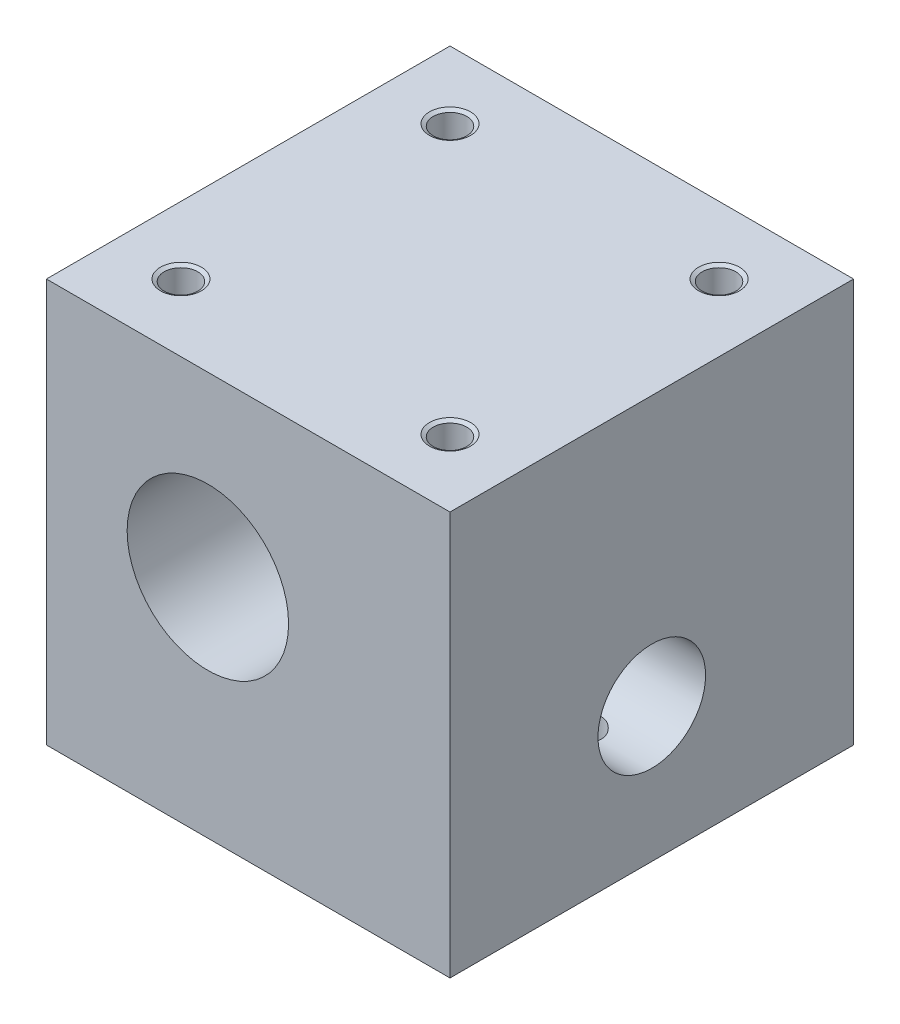
from build123d import *

# Parameters (mm, degrees)
SCHIZZO1_W                     = 30
SCHIZZO1_H                     = 30
SCHIZZO1_R                     = 6
ESTRUSIONE_ESTRUSIONE1_DEPTH   = 30
F_8_0_8_DIAMETER_HOLE1_D       = 8
F_8_0_8_DIAMETER_HOLE1_DEPTH   = 12
F_8_0_8_DIAMETER_HOLE1_TIP     = 2.403442476
FORO_FILETTATO_M3_1_AT_2_COUNT = 2
FORO_FILETTATO_M3_1_AT_2_PITCH = 20
SKETCH1_R                      = 1.25
CUT_EXTRUDE1_DEPTH             = 10


with BuildPart() as part:
    # Schizzo1 → Estrusione-Estrusione1 (new body)
    with BuildSketch(Plane.XY):
        with Locations((15, 15)):
            Rectangle(SCHIZZO1_W, SCHIZZO1_H)
        with Locations((12, 16.8)):
            Circle(SCHIZZO1_R, mode=Mode.SUBTRACT)
    extrude(amount=ESTRUSIONE_ESTRUSIONE1_DEPTH)

    # Ø8.0 (8) Diameter Hole1
    with Locations(Plane(origin=(30, 0, 0), x_dir=(0, 0, -1), z_dir=(1, 0, 0))):
        with Locations((-15, 10)):
            Hole(F_8_0_8_DIAMETER_HOLE1_D / 2, depth=F_8_0_8_DIAMETER_HOLE1_DEPTH)
            with Locations((0, 0, -(F_8_0_8_DIAMETER_HOLE1_DEPTH + F_8_0_8_DIAMETER_HOLE1_TIP / 2))):  # 118° drill point
                Cone(0, F_8_0_8_DIAMETER_HOLE1_D / 2, F_8_0_8_DIAMETER_HOLE1_TIP, mode=Mode.SUBTRACT)

    # Schizzo7 → Foro filettato M3-1 (revolve, cut)
    with BuildSketch(Plane(origin=(5, 30, 25), x_dir=(0, 0, 1), z_dir=(1, 0, 0))):
        Polygon((0, 0), (0, 9.251075774), (1.25, 8.5), (1.25, 0.158771324), (1.525, 0), align=None)
    foro_filettato_m3_1 = revolve(axis=Axis((5, 36.35, 25), (0, -1, 0)), mode=Mode.SUBTRACT)

    # Foro filettato M3-1 at 2: Foro filettato M3-1 ×2
    with Locations(*[(i * FORO_FILETTATO_M3_1_AT_2_PITCH, 0, 0) for i in range(1, FORO_FILETTATO_M3_1_AT_2_COUNT)]):
        add(foro_filettato_m3_1, mode=Mode.SUBTRACT)

    # Specchia1: Foro filettato M3-1 across plane
    add(foro_filettato_m3_1.mirror(Plane.XY.offset(15)), mode=Mode.SUBTRACT)

    # Specchia1 copy 1 sketch → Specchia1 copy 1 (revolve, cut)
    with BuildSketch(Plane(origin=(25, 30, 5), x_dir=(0, 0, -1), z_dir=(1, 0, 0))):
        Polygon((0, 0), (0, -9.251075774), (1.25, -8.5), (1.25, -0.158771324), (1.525, 0), align=None)
    revolve(axis=Axis((25, 36.35, 5), (0, 1, 0)), mode=Mode.SUBTRACT)

    # Sketch1 → Cut-Extrude1 (cut)
    with BuildSketch(Plane.XZ):
        with Locations(Location((25, 15, 0), (0, 0, 270))):
            Circle(SKETCH1_R)
    extrude(amount=-CUT_EXTRUDE1_DEPTH, mode=Mode.SUBTRACT)


solid = part.part
